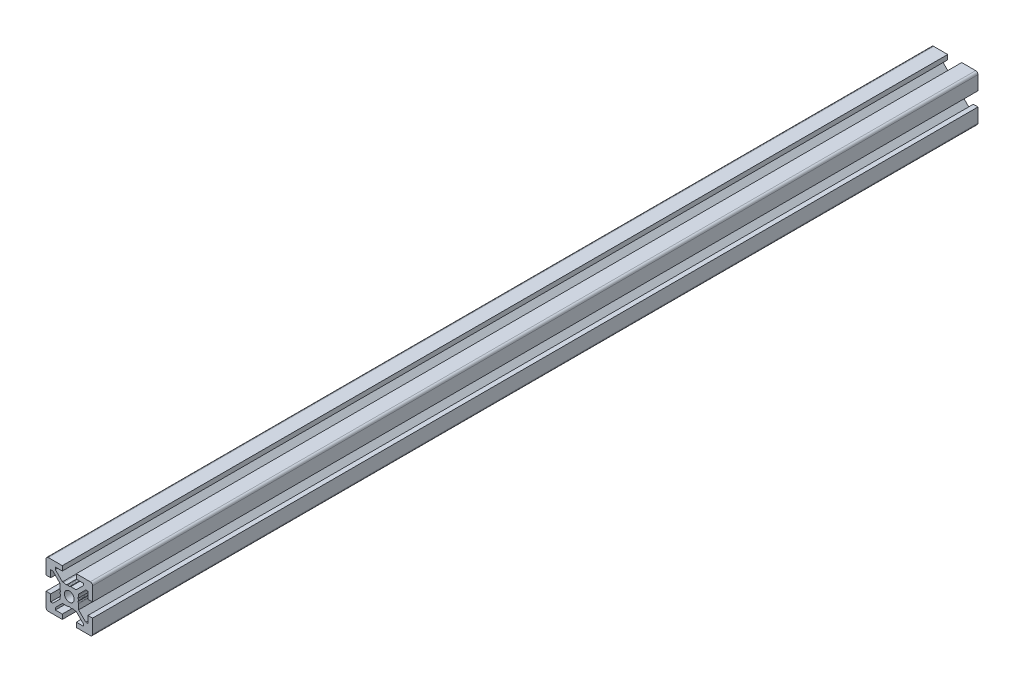
from build123d import *

# Parameters (mm, degrees)
SKETCH1_R           = 2.1
BOSS_EXTRUDE1_DEPTH = 380


with BuildPart() as part:
    # Sketch1 → Boss-Extrude1 (new body)
    with BuildSketch(Plane(origin=(0, 0, -2000), x_dir=(-1, 0, 0), z_dir=(0, 0, -1))):
        with BuildLine():
            Line((10, -3), (8, -3))
            Line((8, -3), (8, -6))
            Line((8, -6), (7.060660172, -6))
            Line((7.060660172, -6), (4, -2.939339828))
            Line((4, -2.939339828), (4, -2.5))
            Line((4, -2.5), (3.750976592, -1.218885629))
            Line((3.750976592, -1.218885629), (3.933012702, -0.903589838))
            ThreePointArc((3.933012702, -0.903589838), (4, -0.653589838), (3.933012702, -0.403589838))
            Line((3.933012702, -0.403589838), (3.7, 0))
            Line((3.7, 0), (3.933012702, 0.403589838))
            ThreePointArc((3.933012702, 0.403589838), (3.982962913, 0.524180316), (4, 0.653589838))
            Line((4, 0.653589838), (4, 2.939339828))
            Line((4, 2.939339828), (7.060660172, 6))
            Line((7.060660172, 6), (8, 6))
            Line((8, 6), (8, 3))
            Line((8, 3), (10, 3))
            Line((10, 3), (10, 9))
            ThreePointArc((10, 9), (9.707106781, 9.707106781), (9, 10))
            Line((9, 10), (3, 10))
            Line((3, 10), (3, 8))
            Line((3, 8), (6, 8))
            Line((6, 8), (6, 7.060660172))
            Line((6, 7.060660172), (2.939339828, 4))
            Line((2.939339828, 4), (2.5, 4))
            Line((2.5, 4), (1.218885629, 3.750976592))
            Line((1.218885629, 3.750976592), (0.903589838, 3.933012702))
            ThreePointArc((0.903589838, 3.933012702), (0.653589838, 4), (0.403589838, 3.933012702))
            Line((0.403589838, 3.933012702), (0, 3.7))
            Line((0, 3.7), (-0.403589838, 3.933012702))
            ThreePointArc((-0.403589838, 3.933012702), (-0.524180316, 3.982962913), (-0.653589838, 4))
            Line((-0.653589838, 4), (-2.939339828, 4))
            Line((-2.939339828, 4), (-6, 7.060660172))
            Line((-6, 7.060660172), (-6, 8))
            Line((-6, 8), (-3, 8))
            Line((-3, 8), (-3, 10))
            Line((-3, 10), (-9, 10))
            ThreePointArc((-9, 10), (-9.707106781, 9.707106781), (-10, 9))
            Line((-10, 9), (-10, 3))
            Line((-10, 3), (-8, 3))
            Line((-8, 3), (-8, 6))
            Line((-8, 6), (-7.060660172, 6))
            Line((-7.060660172, 6), (-4, 2.939339828))
            Line((-4, 2.939339828), (-4, 2.5))
            Line((-4, 2.5), (-3.750976592, 1.218885629))
            Line((-3.750976592, 1.218885629), (-3.933012702, 0.903589838))
            ThreePointArc((-3.933012702, 0.903589838), (-4, 0.653589838), (-3.933012702, 0.403589838))
            Line((-3.933012702, 0.403589838), (-3.7, 0))
            Line((-3.7, 0), (-3.933012702, -0.403589838))
            ThreePointArc((-3.933012702, -0.403589838), (-3.982962913, -0.524180316), (-4, -0.653589838))
            Line((-4, -0.653589838), (-4, -2.939339828))
            Line((-4, -2.939339828), (-7.060660172, -6))
            Line((-7.060660172, -6), (-8, -6))
            Line((-8, -6), (-8, -3))
            Line((-8, -3), (-10, -3))
            Line((-10, -3), (-10, -9))
            ThreePointArc((-10, -9), (-9.707106781, -9.707106781), (-9, -10))
            Line((-9, -10), (-3, -10))
            Line((-3, -10), (-3, -8))
            Line((-3, -8), (-6, -8))
            Line((-6, -8), (-6, -7.060660172))
            Line((-6, -7.060660172), (-2.939339828, -4))
            Line((-2.939339828, -4), (-2.5, -4))
            Line((-2.5, -4), (-1.218885629, -3.750976592))
            Line((-1.218885629, -3.750976592), (-0.903589838, -3.933012702))
            ThreePointArc((-0.903589838, -3.933012702), (-0.653589838, -4), (-0.403589838, -3.933012702))
            Line((-0.403589838, -3.933012702), (0, -3.7))
            Line((0, -3.7), (0.403589838, -3.933012702))
            ThreePointArc((0.403589838, -3.933012702), (0.524180316, -3.982962913), (0.653589838, -4))
            Line((0.653589838, -4), (2.939339828, -4))
            Line((2.939339828, -4), (6, -7.060660172))
            Line((6, -7.060660172), (6, -8))
            Line((6, -8), (3, -8))
            Line((3, -8), (3, -10))
            Line((3, -10), (9, -10))
            ThreePointArc((9, -10), (9.707106781, -9.707106781), (10, -9))
            Line((10, -9), (10, -3))
        make_face()
        with Locations(Location((0, 0, 0), (0, 0, 180))):
            Circle(SKETCH1_R, mode=Mode.SUBTRACT)
    extrude(amount=-BOSS_EXTRUDE1_DEPTH)


solid = part.part
